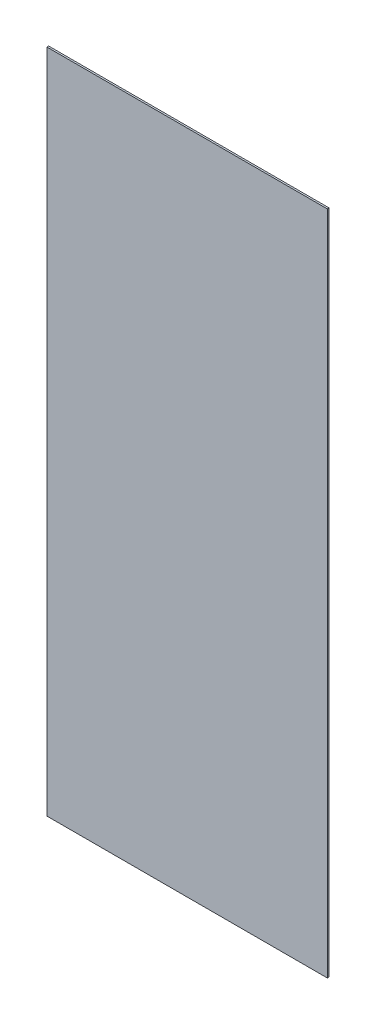
from build123d import *

# Parameters (mm, degrees)
SZKIC1_W                    = 800
SZKIC1_H                    = 1900
DODANIE_WYCI_GNI_CIE1_DEPTH = 5


with BuildPart() as part:
    # Szkic1 → Dodanie-wyciągnięcie1 (new body)
    with BuildSketch(Plane.XY):
        with Locations((400, 950)):
            Rectangle(SZKIC1_W, SZKIC1_H)
    extrude(amount=DODANIE_WYCI_GNI_CIE1_DEPTH)


solid = part.part
